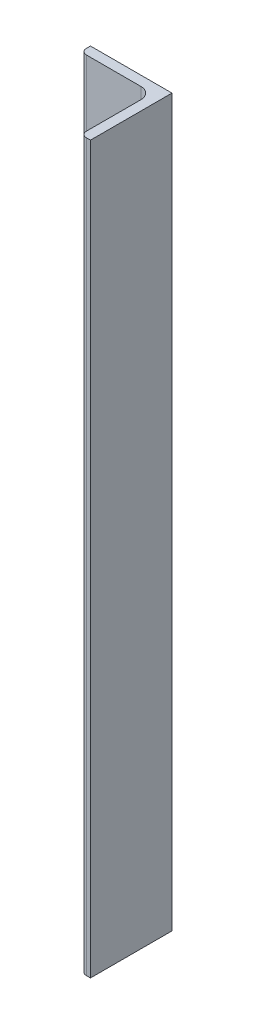
from build123d import *

# Parameters (mm, degrees)
BOSS_EXTRUDE1_DEPTH = 222.5


with BuildPart() as part:
    # Sketch1 → Boss-Extrude1 (new, symmetric)
    with BuildSketch(Plane(origin=(0, 0, 0), x_dir=(1, 0, 0), z_dir=(0, 1, 0))):
        with BuildLine():
            Line((0, 0), (-50, 0))
            Line((-50, 0), (-50, -2.5))
            ThreePointArc((-50, -2.5), (-48.974873734, -4.974873734), (-46.5, -6))
            Line((-46.5, -6), (-13, -6))
            ThreePointArc((-13, -6), (-8.050252532, -8.050252532), (-6, -13))
            Line((-6, -13), (-6, -46.5))
            ThreePointArc((-6, -46.5), (-4.974873734, -48.974873734), (-2.5, -50))
            Line((-2.5, -50), (0, -50))
            Line((0, -50), (0, 0))
        make_face()
    extrude(amount=BOSS_EXTRUDE1_DEPTH, both=True)


solid = part.part
